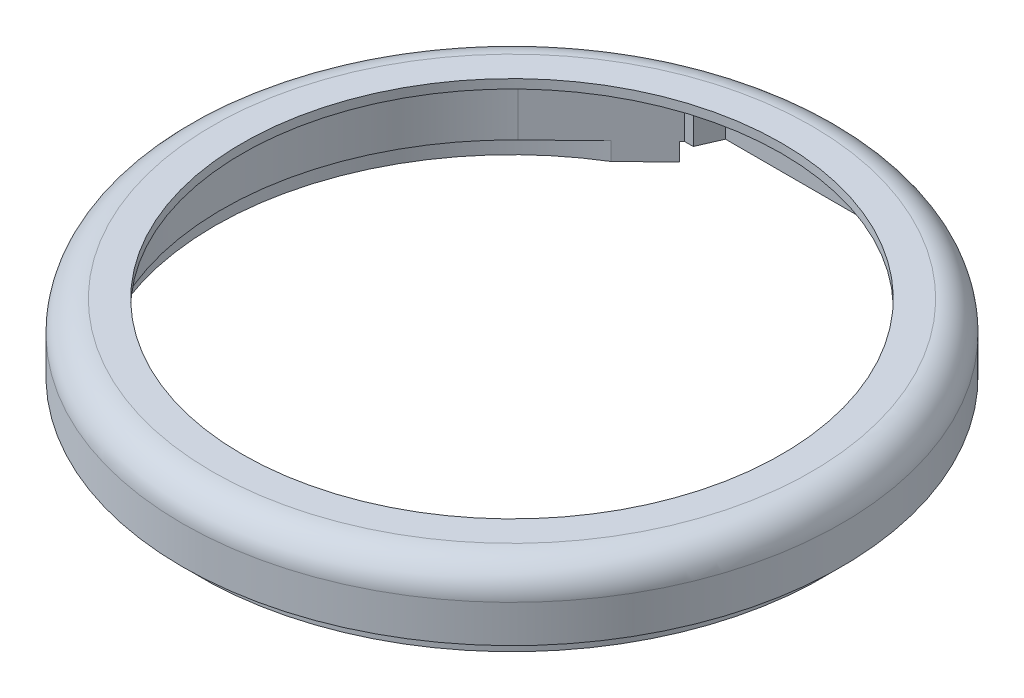
from build123d import *

# Parameters (mm, degrees)
SKETCH1_R               = 22
BOSS_EXTRUDE1_DEPTH     = 4.5
SKETCH2_R               = 20.8
SKETCH2_R_2             = 19.84
BOSS_EXTRUDE2_DEPTH     = 1.2
SKETCH3_R               = 18
CUT_EXTRUDE1_DEPTH      = 32.630523233
CUT_EXTRUDE2_DEPTH      = 32.436443819
CUT_EXTRUDE2_DEPTH_BACK = 3.9
CUT_EXTRUDE3_DEPTH      = 32.436443819
CUT_EXTRUDE3_DEPTH_BACK = 3.1
FILLET1_R               = 2
FILLET2_R               = 1
CUT_EXTRUDE4_DEPTH      = 32.436443819


with BuildPart() as part:
    # Sketch1 → Boss-Extrude1 (new body)
    with BuildSketch(Plane(origin=(0, 0, 0), x_dir=(1, 0, 0), z_dir=(0, 1, 0))):
        with Locations(Location((0, 0, 0), (0, 0, 270))):
            Circle(SKETCH1_R)
    extrude(amount=BOSS_EXTRUDE1_DEPTH)

    # Sketch2 → Boss-Extrude2 (add)
    with BuildSketch(Plane.XZ):
        with Locations(Location((0, 0, 0), (0, 0, 90))):
            Circle(SKETCH2_R)
        with Locations(Location((0, 0, 0), (0, 0, 270))):
            Circle(SKETCH2_R_2, mode=Mode.SUBTRACT)
    extrude(amount=BOSS_EXTRUDE2_DEPTH)

    # Sketch3 → Cut-Extrude1 (cut, through all)
    with BuildSketch(Plane(origin=(0, 4.5, 0), x_dir=(1, 0, 0), z_dir=(0, 1, 0))):
        with Locations(Location((0, 0, 0), (0, 0, 270))):
            Circle(SKETCH3_R)
    extrude(amount=-CUT_EXTRUDE1_DEPTH, mode=Mode.SUBTRACT)

    # Sketch4 → Cut-Extrude2 (cut, two sides: drawn at the far end of the back side and taken through both)
    with BuildSketch(Plane.XZ.offset(-CUT_EXTRUDE2_DEPTH_BACK)):
        with BuildLine():
            Line((-13.481253655, -13.88086092), (-7.85, -19.35))
            Line((-7.85, -19.35), (7.85, -19.35))
            Line((7.85, -19.35), (13.481253655, -13.88086092))
            ThreePointArc((13.481253655, -13.88086092), (0, 19.35), (-13.481253655, -13.88086092))
        make_face()
    extrude(amount=CUT_EXTRUDE2_DEPTH + CUT_EXTRUDE2_DEPTH_BACK, mode=Mode.SUBTRACT)

    # Sketch5 → Cut-Extrude3 (cut, two sides: drawn at the far end of the back side and taken through both)
    with BuildSketch(Plane.XZ.offset(-CUT_EXTRUDE3_DEPTH_BACK)):
        Polygon((-6.6, -20.85), (6.6, -20.85), (7.25, -19.35), (-7.25, -19.35), align=None)
    extrude(amount=CUT_EXTRUDE3_DEPTH + CUT_EXTRUDE3_DEPTH_BACK, mode=Mode.SUBTRACT)

    # Fillet1
    fillet1_edges = [part.edges().sort_by_distance(p)[0] for p in [
        (0, 4.5, -22),
    ]]
    fillet(fillet1_edges, radius=FILLET1_R)

    # Fillet2
    fillet2_edges = [part.edges().sort_by_distance(p)[0] for p in [
        (0, 3.1, -20.85),
    ]]
    fillet(fillet2_edges, radius=FILLET2_R)

    # Sketch6 → Cut-Extrude4 (cut, through all)
    with BuildSketch(Plane.XZ):
        with BuildLine():
            Line((7.25, -19.35), (7.174883279, -19.523346279))
            ThreePointArc((7.174883279, -19.523346279), (7.402968696, -19.438005414), (7.630039318, -19.35))
            Line((7.630039318, -19.35), (7.25, -19.35))
        make_face()
        with BuildLine():
            Line((-7.174883279, -19.523346279), (-7.25, -19.35))
            Line((-7.25, -19.35), (-7.630039318, -19.35))
            ThreePointArc((-7.630039318, -19.35), (-7.402968696, -19.438005414), (-7.174883279, -19.523346279))
        make_face()
    extrude(amount=CUT_EXTRUDE4_DEPTH, mode=Mode.SUBTRACT)


solid = part.part
